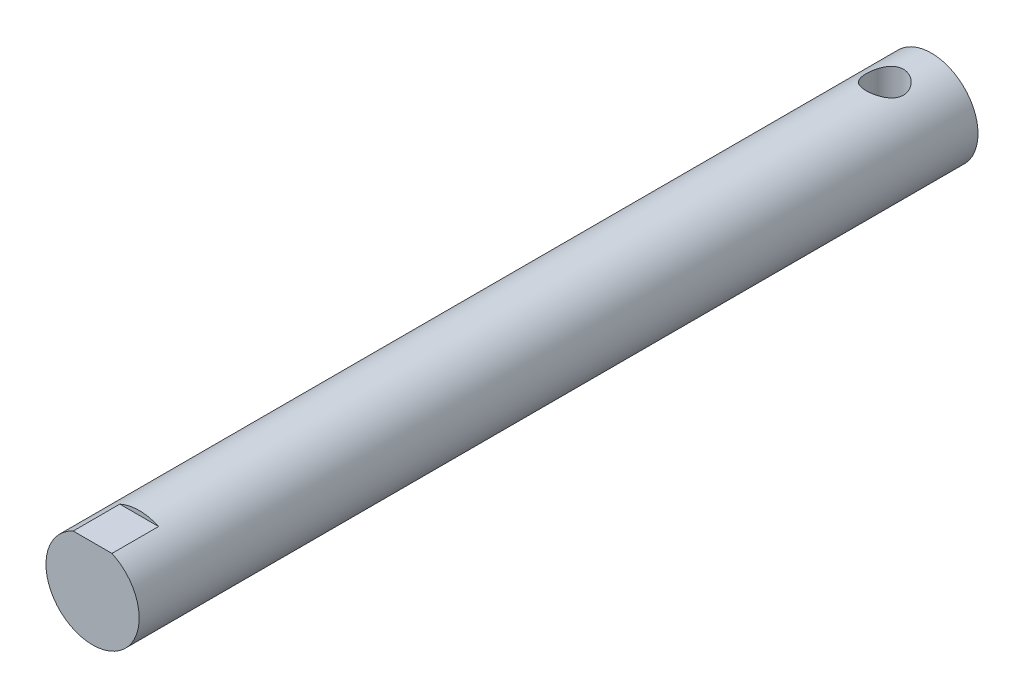
from build123d import *

# Parameters (mm, degrees)
SKETCH1_R               = 10
BOSS_EXTRUDE1_DEPTH     = 180
CUT_EXTRUDE1_DEPTH      = 181.554700853
CUT_EXTRUDE1_DEPTH_BACK = 181.554700853
SKETCH2_R               = 4
CUT_EXTRUDE2_START      = -10
CUT_EXTRUDE2_DEPTH      = 10


with BuildPart() as part:
    # Sketch1 → Boss-Extrude1 (new body)
    with BuildSketch(Plane.XY):
        with Locations(Location((0, 0, 0), (0, 0, 180))):
            Circle(SKETCH1_R)
    extrude(amount=BOSS_EXTRUDE1_DEPTH)

    # Sketch2 → Cut-Extrude1 (cut, two sides: drawn at the far end of the back side and taken through both)
    with BuildSketch(Plane(origin=(0, 0, 0), x_dir=(1, 0, 0), z_dir=(0, 1, 0)).offset(-CUT_EXTRUDE1_DEPTH_BACK)):
        with Locations(Location((0, -10, 0), (0, 0, 270))):
            Circle(SKETCH2_R)
    extrude(amount=CUT_EXTRUDE1_DEPTH + CUT_EXTRUDE1_DEPTH_BACK, mode=Mode.SUBTRACT)

    # Sketch3 → Cut-Extrude2 (cut)
    with BuildSketch(Plane.XY.offset(180).offset(CUT_EXTRUDE2_START)):
        with BuildLine():
            Line((-4.161531139, 9.092945539), (4.161531139, 9.092945539))
            ThreePointArc((4.161531139, 9.092945539), (0, 10), (-4.161531139, 9.092945539))
        make_face()
    extrude(amount=CUT_EXTRUDE2_DEPTH, mode=Mode.SUBTRACT)


solid = part.part
